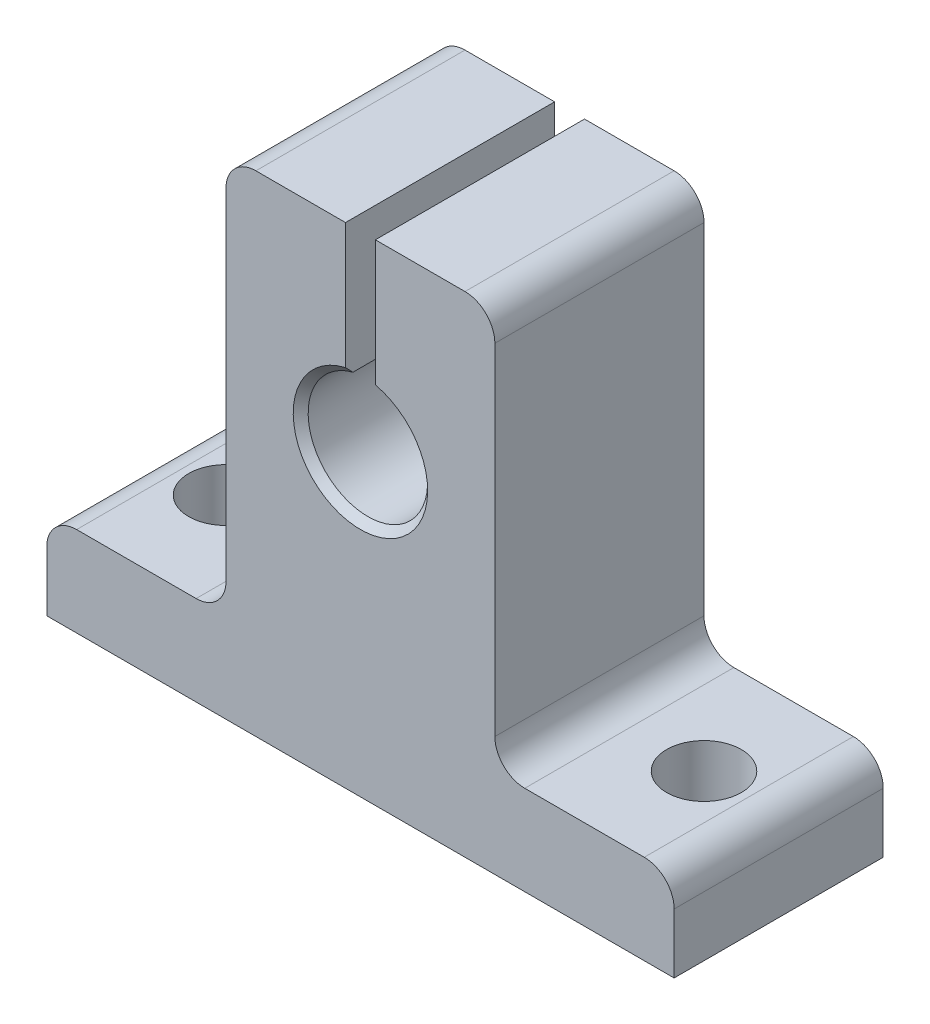
from build123d import *

# Parameters (mm, degrees)
BOSS_EXTRUDE1_DEPTH   = 14
CHAMFER1_SIZE         = 0.5
M6X1_0_TAPPED_HOLE1_D = 5


with BuildPart() as part:
    # Sketch1 → Boss-Extrude1 (new body)
    with BuildSketch(Plane.XY):
        with BuildLine():
            Line((-21, 4), (-21, 0))
            Line((-21, 0), (21, 0))
            Line((21, 0), (21, 4))
            ThreePointArc((21, 4), (20.414213562, 5.414213562), (19, 6))
            Line((19, 6), (11, 6))
            ThreePointArc((11, 6), (9.585786438, 6.585786438), (9, 8))
            Line((9, 8), (9, 30.8))
            ThreePointArc((9, 30.8), (8.414213562, 32.214213562), (7, 32.8))
            Line((7, 32.8), (1, 32.8))
            Line((1, 32.8), (1, 23.872983346))
            ThreePointArc((1, 23.872983346), (0, 16), (-1, 23.872983346))
            Line((-1, 23.872983346), (-1, 32.8))
            Line((-1, 32.8), (-7, 32.8))
            ThreePointArc((-7, 32.8), (-8.414213562, 32.214213562), (-9, 30.8))
            Line((-9, 30.8), (-9, 8))
            ThreePointArc((-9, 8), (-9.585786438, 6.585786438), (-11, 6))
            Line((-11, 6), (-19, 6))
            ThreePointArc((-19, 6), (-20.414213562, 5.414213562), (-21, 4))
        make_face()
    extrude(amount=BOSS_EXTRUDE1_DEPTH)

    # Chamfer1
    chamfer1_edges = [part.edges().sort_by_distance(p)[0] for p in [
        (0, 16, 0),
        (0, 16, 14),
    ]]
    chamfer(chamfer1_edges, length=CHAMFER1_SIZE)

    # M6x1.0 Tapped Hole1 (through all)
    with Locations(Plane(origin=(0, 6, 0), x_dir=(1, 0, 0), z_dir=(0, 1, 0))):
        with Locations((-16, -7), (16, -7)):
            Hole(M6X1_0_TAPPED_HOLE1_D / 2)


solid = part.part
